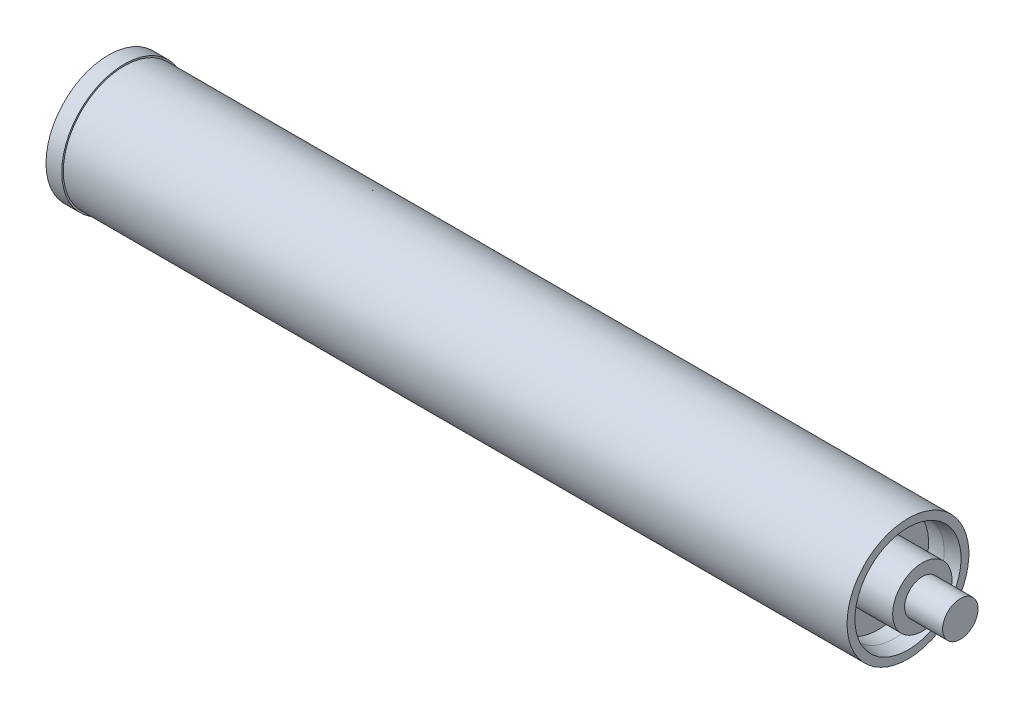
from build123d import *


with BuildPart() as part:
    # Esquisse2 → Révolution7 (revolve)
    with BuildSketch(Plane.XY, mode=Mode.PRIVATE) as r_volution7_sk:
        Polygon((0, 26), (12.7, 26), (36.56741584, 26), (36.56741584, 35.689138439), (25.4, 35.689138439), (12.7, 38.2095), (12.7, 50.419), (25.4, 50.419), (25.4, 49.149), (657.7598, 49.149), (657.7598, 42.820187711), (646.43694835, 40.573126289), (633.864418395, 40.573126289), (633.864418395, 23.9395), (669.332507907, 23.9395), (669.332507907, 14.2875), (700, 14.2875), (700, 0), (0, 0), align=None)
    revolve(r_volution7_sk.sketch.rotate(Axis((0, 0, 0), (1, 0, 0)), 90), axis=Axis((0, 0, 0), (1, 0, 0)))

    # Esquisse3 → Enlèvement de matière-Révolution1 (revolve, cut)
    with BuildSketch(Plane.XY, mode=Mode.PRIVATE) as enl_vement_de_mati_re_r_volution1_sk:
        Polygon((0, 20), (0, 0), (633.864418395, 0), (633.864418395, 12.957757221), (616.513878227, 12.957757221), (616.513878227, 44.271024873), (65.871878934, 44.271024873), (34.08300614, 14.327580407), (19.08300614, 14.327580407), align=None)
    revolve(enl_vement_de_mati_re_r_volution1_sk.sketch.rotate(Axis((0, 0, 0), (1, 0, 0)), 90), axis=Axis((0, 0, 0), (1, 0, 0)), mode=Mode.SUBTRACT)


solid = part.part
